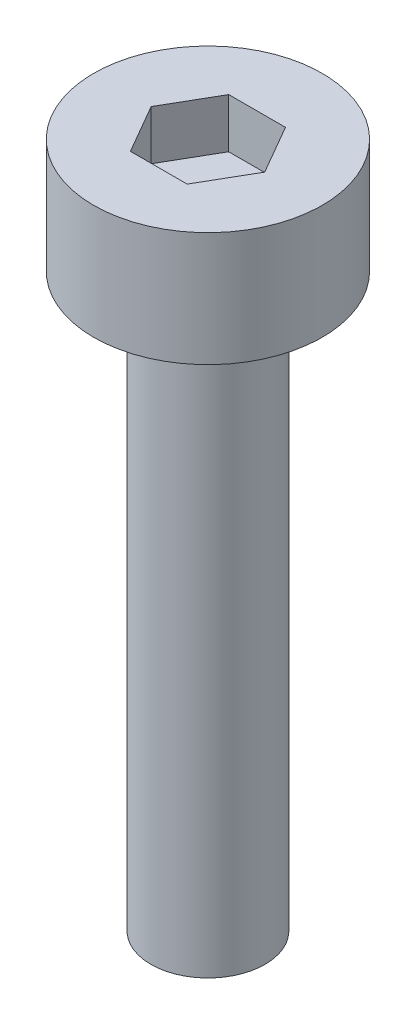
from build123d import *

# Parameters (mm, degrees)
SKETCH1_R           = 1.5
SCREWSHAFT_DEPTH    = 15
SKETCH2_R           = 3
BOSS_EXTRUDE2_DEPTH = 3
CUT_EXTRUDE1_DEPTH  = 1.3


with BuildPart() as part:
    # Sketch1 → ScrewShaft (new body)
    with BuildSketch(Plane(origin=(0, 0, 0), x_dir=(1, 0, 0), z_dir=(0, 1, 0))):
        with Locations(Location((0, 0, 0), (0, 0, 270))):
            Circle(SKETCH1_R)
    extrude(amount=SCREWSHAFT_DEPTH)

    # Sketch2 → Boss-Extrude2 (add)
    with BuildSketch(Plane(origin=(0, 15, 0), x_dir=(1, 0, 0), z_dir=(0, 1, 0))):
        with Locations(Location((0, 0, 0), (0, 0, 270))):
            Circle(SKETCH2_R)
    extrude(amount=BOSS_EXTRUDE2_DEPTH)

    # Sketch3 → Cut-Extrude1 (cut)
    with BuildSketch(Plane(origin=(0, 18, 0), x_dir=(1, 0, 0), z_dir=(0, 1, 0))):
        Polygon((1.489563695, 0), (0.744781847, 1.29), (-0.744781847, 1.29), (-1.489563695, 0), (-0.744781847, -1.29), (0.744781847, -1.29), align=None)
    extrude(amount=-CUT_EXTRUDE1_DEPTH, mode=Mode.SUBTRACT)


solid = part.part
